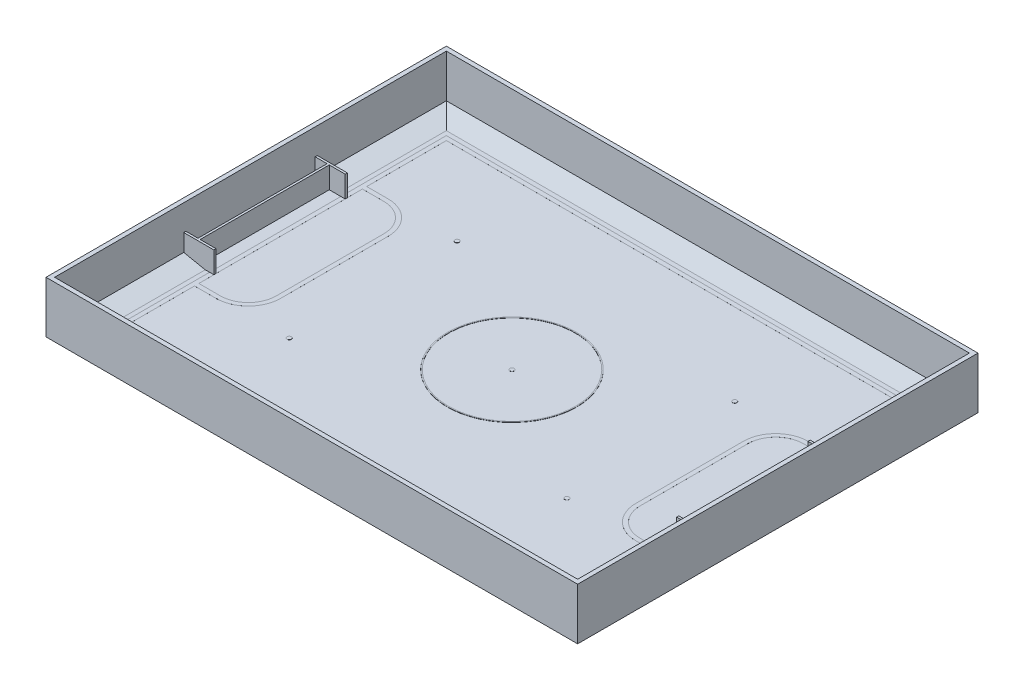
from build123d import *

# Parameters (mm, degrees)
CROQUIS1_W        = 247
CROQUIS1_H        = 186
CROQUIS1_W_2      = 243
CROQUIS1_H_2      = 182
WALL_DEPTH        = 24
CROQUIS4_W        = 243
CROQUIS4_H        = 182
FIELD_DEPTH       = 2
CROQUIS5_W        = 219
CROQUIS5_H        = 158
WHITELINE_DEPTH   = 0.01
CROQUIS6_R        = 30
CROQUIS6_R_2      = 29.5
CROQUIS6_R_3      = 1
NEUTRALZONE_DEPTH = 0.1
CROQUIS8_R        = 1
NEUTRALSPOT_DEPTH = 0.1
GOALS_DEPTH       = 10
WEDGE1_DEPTH      = 243
WEDGE2_DEPTH      = 60
WEDGE3_DEPTH      = 60


with BuildPart() as part:
    # Croquis1 → Wall (new body)
    with BuildSketch(Plane(origin=(0, 0, 0), x_dir=(1, 0, 0), z_dir=(0, 1, 0))):
        with Locations((121.5, 91)):
            Rectangle(CROQUIS1_W, CROQUIS1_H)
        with Locations((121.5, 91)):
            Rectangle(CROQUIS1_W_2, CROQUIS1_H_2, mode=Mode.SUBTRACT)
    extrude(amount=WALL_DEPTH)

    # Croquis4 → Field (add)
    with BuildSketch(Plane(origin=(0, 0, 0), x_dir=(1, 0, 0), z_dir=(0, 1, 0))):
        with Locations((121.5, 91)):
            Rectangle(CROQUIS4_W, CROQUIS4_H)
    extrude(amount=FIELD_DEPTH)

    # Croquis5 → WhiteLine (add)
    with BuildSketch(Plane(origin=(0, 2, 0), x_dir=(1, 0, 0), z_dir=(0, 1, 0))):
        with Locations((121.5, 91)):
            Rectangle(CROQUIS5_W, CROQUIS5_H)
        with BuildLine():
            Line((229, 14), (14, 14))
            Line((14, 14), (14, 51))
            Line((14, 51), (24, 51))
            ThreePointArc((24, 51), (34.606601718, 55.393398282), (39, 66))
            Line((39, 66), (39, 91))
            Line((39, 91), (39, 116))
            ThreePointArc((39, 116), (34.606601718, 126.606601718), (24, 131))
            Line((24, 131), (14, 131))
            Line((14, 131), (14, 168))
            Line((14, 168), (229, 168))
            Line((229, 168), (229, 131))
            Line((229, 131), (219, 131))
            ThreePointArc((219, 131), (208.393398282, 126.606601718), (204, 116))
            Line((204, 116), (204, 91))
            Line((204, 91), (204, 66))
            ThreePointArc((204, 66), (208.393398282, 55.393398282), (219, 51))
            Line((219, 51), (229, 51))
            Line((229, 51), (229, 14))
        make_face(mode=Mode.SUBTRACT)
        with BuildLine():
            Line((219, 53), (229, 53))
            Line((229, 53), (229, 129))
            Line((229, 129), (219, 129))
            ThreePointArc((219, 129), (209.807611845, 125.192388155), (206, 116))
            Line((206, 116), (206, 93))
            Line((206, 93), (206, 89))
            Line((206, 89), (206, 66))
            ThreePointArc((206, 66), (209.807611845, 56.807611845), (219, 53))
        make_face(mode=Mode.SUBTRACT)
        with BuildLine():
            Line((24, 129), (14, 129))
            Line((14, 129), (14, 53))
            Line((14, 53), (24, 53))
            ThreePointArc((24, 53), (33.192388155, 56.807611845), (37, 66))
            Line((37, 66), (37, 89))
            Line((37, 89), (37, 93))
            Line((37, 93), (37, 116))
            ThreePointArc((37, 116), (33.192388155, 125.192388155), (24, 129))
        make_face(mode=Mode.SUBTRACT)
    extrude(amount=WHITELINE_DEPTH)

    # Croquis6 → Neutralzone (add)
    # profile 1 of 5: a face of its own
    with BuildSketch(Plane(origin=(0, 2, 0), x_dir=(1, 0, 0), z_dir=(0, 1, 0))):
        with Locations(Location((121.5, 91, 0), (0, 0, 90))):
            Circle(CROQUIS6_R)
        with Locations(Location((121.5, 91, 0), (0, 0, 270))):
            Circle(CROQUIS6_R_2, mode=Mode.SUBTRACT)
    # profile 2 of 5: a face of its own
    with BuildSketch(Plane(origin=(0, 2, 0), x_dir=(1, 0, 0), z_dir=(0, 1, 0))):
        with Locations(Location((57, 130, 0), (0, 0, 90))):
            Circle(CROQUIS6_R_3)
    # profile 3 of 5: a face of its own
    with BuildSketch(Plane(origin=(0, 2, 0), x_dir=(1, 0, 0), z_dir=(0, 1, 0))):
        with Locations(Location((57, 52, 0), (0, 0, 90))):
            Circle(CROQUIS6_R_3)
    # profile 4 of 5: a face of its own
    with BuildSketch(Plane(origin=(0, 2, 0), x_dir=(1, 0, 0), z_dir=(0, 1, 0))):
        with Locations(Location((186, 52, 0), (0, 0, 90))):
            Circle(CROQUIS6_R_3)
    # profile 5 of 5: a face of its own
    with BuildSketch(Plane(origin=(0, 2, 0), x_dir=(1, 0, 0), z_dir=(0, 1, 0))):
        with Locations(Location((186, 130, 0), (0, 0, 90))):
            Circle(CROQUIS6_R_3)
    extrude(amount=NEUTRALZONE_DEPTH)

    # Croquis8 → NeutralSpot (add)
    with BuildSketch(Plane(origin=(0, 2, 0), x_dir=(1, 0, 0), z_dir=(0, 1, 0))):
        with Locations(Location((121.5, 91, 0), (0, 0, 90))):
            Circle(CROQUIS8_R)
    extrude(amount=NEUTRALSPOT_DEPTH)

    # Croquis9 → Goals (add)
    with BuildSketch(Plane(origin=(0, 2, 0), x_dir=(1, 0, 0), z_dir=(0, 1, 0))):
        Polygon((14, 121), (6.6, 121), (6.6, 91), (6.6, 61), (14, 61), (14, 60), (5.6, 60), (0, 60), (0, 61), (5.6, 61), (5.6, 91), (5.6, 121), (0, 121), (0, 122), (5.6, 122), (14, 122), align=None)
        Polygon((229, 61), (236.4, 61), (236.4, 91), (236.4, 121), (229, 121), (229, 122), (237.4, 122), (243, 122), (243, 121), (237.4, 121), (237.4, 91), (237.4, 61), (243, 61), (243, 60), (237.4, 60), (229, 60), align=None)
    extrude(amount=GOALS_DEPTH)

    # Croquis10 → Wedge1 (add)
    with BuildSketch(Plane(origin=(0, 0, 0), x_dir=(0, 0, -1), z_dir=(1, 0, 0))):
        Polygon((0, 2), (10, 2), (0, 4), align=None)
        Polygon((182, 4), (172, 2), (182, 2), align=None)
    extrude(amount=WEDGE1_DEPTH)

    # Croquis11 → Wedge2 (add)
    with BuildSketch(Plane(origin=(0, 0, 0), x_dir=(-1, 0, 0), z_dir=(0, 0, -1))):
        Polygon((0, 4), (0, 2), (-10, 2), align=None)
        Polygon((-233, 2), (-243, 4), (-243, 2), align=None)
    extrude(amount=WEDGE2_DEPTH)

    # Croquis12 → Wedge3 (add)
    with BuildSketch(Plane.XY.offset(-182)):
        Polygon((0, 4), (0, 2), (10, 2), align=None)
        Polygon((233, 2), (243, 4), (243, 2), align=None)
    extrude(amount=WEDGE3_DEPTH)


solid = part.part
